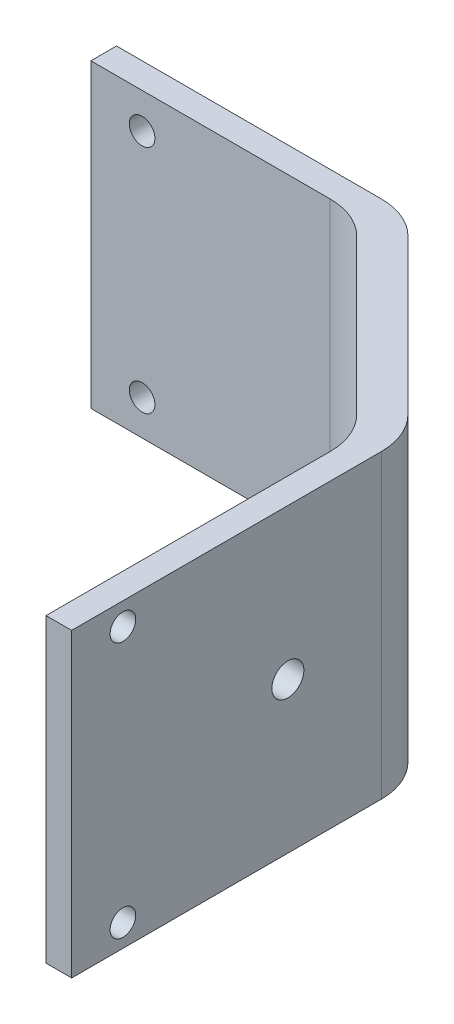
from build123d import *

# Parameters (mm, degrees)
SKETCH2_W            = 71.5
SKETCH2_H            = 11
BOSS_EXTRUDE2_DEPTH  = 4
SKETCH3_R            = 2
CUT_EXTRUDE1_DEPTH   = 4
SKETCH4_W            = 4
SKETCH4_H            = 4
BOSS_EXTRUDE3_DEPTH  = 11
SKETCH5_W            = 4
SKETCH5_H            = 11
BOSS_EXTRUDE4_DEPTH  = 76
SKETCH7_W            = 75.5
SKETCH7_H            = 11
SKETCH7_R            = 2
BOSS_EXTRUDE5_DEPTH  = 4
SKETCH8_W            = 80
SKETCH8_H            = 11
BOSS_EXTRUDE8_DEPTH  = 4
BOSS_EXTRUDE9_DEPTH  = 25
SKETCH10_R           = 2.5
CUT_EXTRUDE3_DEPTH   = 4
CHAMFER1_SIZE        = 30
SKETCH13_R           = 2
CUT_EXTRUDE4_DEPTH   = 4
BOSS_EXTRUDE10_DEPTH = 4
FILLET1_R            = 10


with BuildPart() as part:
    # Sketch2 → Boss-Extrude2 (new body)
    with BuildSketch(Plane.XY):
        with Locations((35.75, 5.5)):
            Rectangle(SKETCH2_W, SKETCH2_H)
    extrude(amount=BOSS_EXTRUDE2_DEPTH)

    # Sketch3 → Cut-Extrude1 (cut)
    with BuildSketch(Plane.XY.offset(4)):
        with Locations((8, 5.5)):
            Circle(SKETCH3_R)
    extrude(amount=-CUT_EXTRUDE1_DEPTH, mode=Mode.SUBTRACT)

    # Sketch4 → Boss-Extrude3 (add)
    with BuildSketch(Plane(origin=(0, 11, 0), x_dir=(1, 0, 0), z_dir=(0, 1, 0))):
        with Locations((73.5, -2)):
            Rectangle(SKETCH4_W, SKETCH4_H)
    extrude(amount=-BOSS_EXTRUDE3_DEPTH)

    # Sketch5 → Boss-Extrude4 (add)
    with BuildSketch(Plane.XY.offset(4)):
        with Locations((73.5, 5.5)):
            Rectangle(SKETCH5_W, SKETCH5_H)
    extrude(amount=BOSS_EXTRUDE4_DEPTH)



with BuildPart() as body_2:
    # Sketch7 → Boss-Extrude5 (new body)
    with BuildSketch(Plane(origin=(0, 0, 0), x_dir=(-1, 0, 0), z_dir=(0, 0, -1))):
        with Locations((-37.75, 41.5)):
            Rectangle(SKETCH7_W, SKETCH7_H)
        with Locations((-8, 41.5)):
            Circle(SKETCH7_R, mode=Mode.SUBTRACT)
    extrude(amount=-BOSS_EXTRUDE5_DEPTH)

    # Sketch8 → Boss-Extrude8 (add)
    with BuildSketch(Plane(origin=(75.5, 0, 0), x_dir=(0, 0, -1), z_dir=(1, 0, 0))):
        with Locations((-40, 41.5)):
            Rectangle(SKETCH8_W, SKETCH8_H)
    extrude(amount=-BOSS_EXTRUDE8_DEPTH)


with BuildPart() as part_1:
    add(part.part)

    add(body_2.part)  # Boss-Extrude9 merges body 2
    # Sketch9 → Boss-Extrude9 (add)
    with BuildSketch(Plane(origin=(0, 11, 0), x_dir=(1, 0, 0), z_dir=(0, 1, 0))):
        Polygon((75.5, 0), (0, 0), (0, -4), (71.5, -4), (71.5, -80), (75.5, -80), align=None)
    extrude(amount=BOSS_EXTRUDE9_DEPTH)

    # Sketch10 → Cut-Extrude3 (cut)
    with BuildSketch(Plane(origin=(75.5, 0, 0), x_dir=(0, 0, -1), z_dir=(1, 0, 0))):
        with Locations((-48.75, 23.5)):
            Circle(SKETCH10_R)
    extrude(amount=-CUT_EXTRUDE3_DEPTH, mode=Mode.SUBTRACT)

    # Chamfer1
    chamfer1_edges = [part_1.edges().sort_by_distance(p)[0] for p in [
        (75.5, 23.5, 0),
        (71.5, 23.5, 4),
    ]]
    chamfer(chamfer1_edges, length=CHAMFER1_SIZE)

    # Sketch13 → Cut-Extrude4 (cut)
    with BuildSketch(Plane(origin=(75.5, 0, 0), x_dir=(0, 0, -1), z_dir=(1, 0, 0))):
        with Locations((-74.5, 3.5)):
            Circle(SKETCH13_R)
        with Locations((-74.5, 43.5)):
            Circle(SKETCH13_R)
    extrude(amount=-CUT_EXTRUDE4_DEPTH, mode=Mode.SUBTRACT)

    # Sketch14 → Boss-Extrude10 (add)
    with BuildSketch(Plane(origin=(75.5, 0, 0), x_dir=(0, 0, -1), z_dir=(1, 0, 0))):
        Polygon((-82.5, 3.5), (-82.5, 47), (-80, 47), (-80, 0), (-82.5, 0), align=None)
    extrude(amount=-BOSS_EXTRUDE10_DEPTH)

    # Fillet1
    fillet1_edges = [part_1.edges().sort_by_distance(p)[0] for p in [
        (71.5, 23.5, 34),
        (41.5, 23.5, 4),
        (75.5, 23.5, 30),
        (45.5, 23.5, 0),
    ]]
    fillet(fillet1_edges, radius=FILLET1_R)


solid = part_1.part
